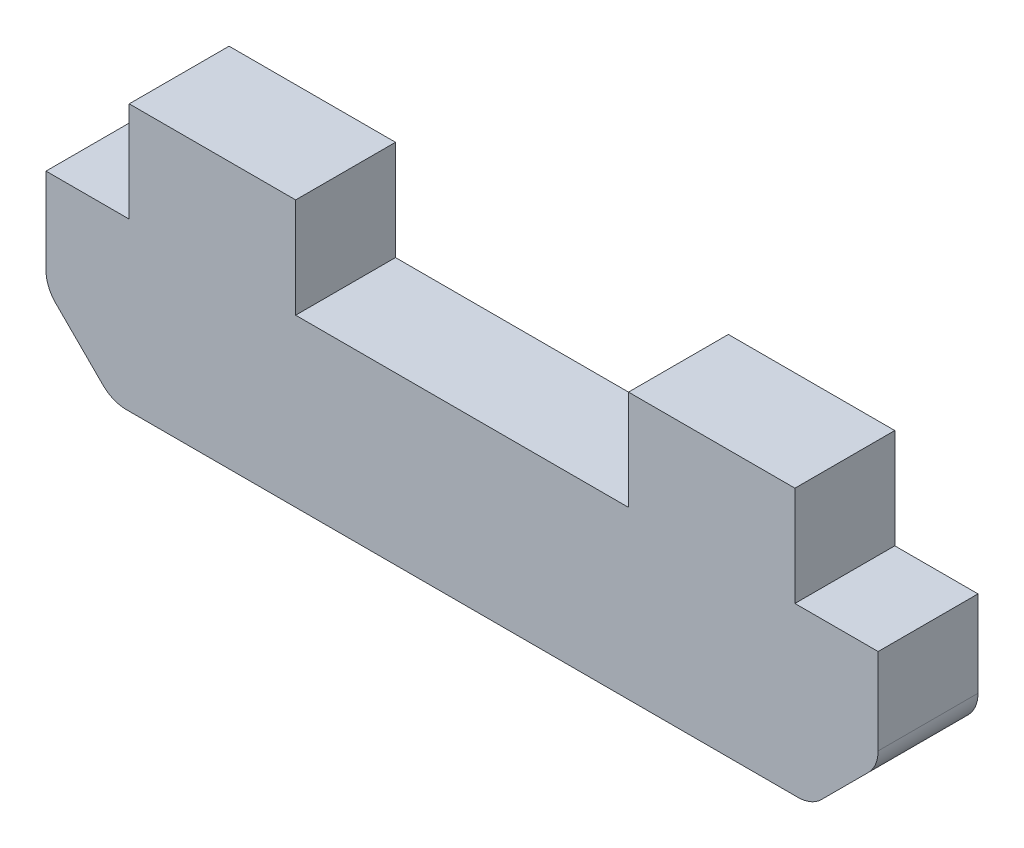
from build123d import *

# Parameters (mm, degrees)
BOSS_EXTRUDE1_DEPTH = 3
CHAMFER1_SIZE       = 2
FILLET1_R           = 1


with BuildPart() as part:
    # Sketch1 → Boss-Extrude1 (new body)
    with BuildSketch(Plane.XY):
        Polygon((0, 0), (25, 0), (25, 5), (22.5, 5), (22.5, 8), (17.5, 8), (17.5, 5), (7.5, 5), (7.5, 8), (2.5, 8), (2.5, 5), (0, 5), align=None)
    extrude(amount=BOSS_EXTRUDE1_DEPTH)

    # Chamfer1
    chamfer1_edges = [part.edges().sort_by_distance(p)[0] for p in [
        (25, 0, 1.5),
        (0, 0, 1.5),
    ]]
    chamfer(chamfer1_edges, length=CHAMFER1_SIZE)

    # Fillet1
    fillet1_edges = [part.edges().sort_by_distance(p)[0] for p in [
        (25, 2, 1.5),
        (2, 0, 1.5),
        (23, 0, 1.5),
        (0, 2, 1.5),
    ]]
    fillet(fillet1_edges, radius=FILLET1_R)


solid = part.part
